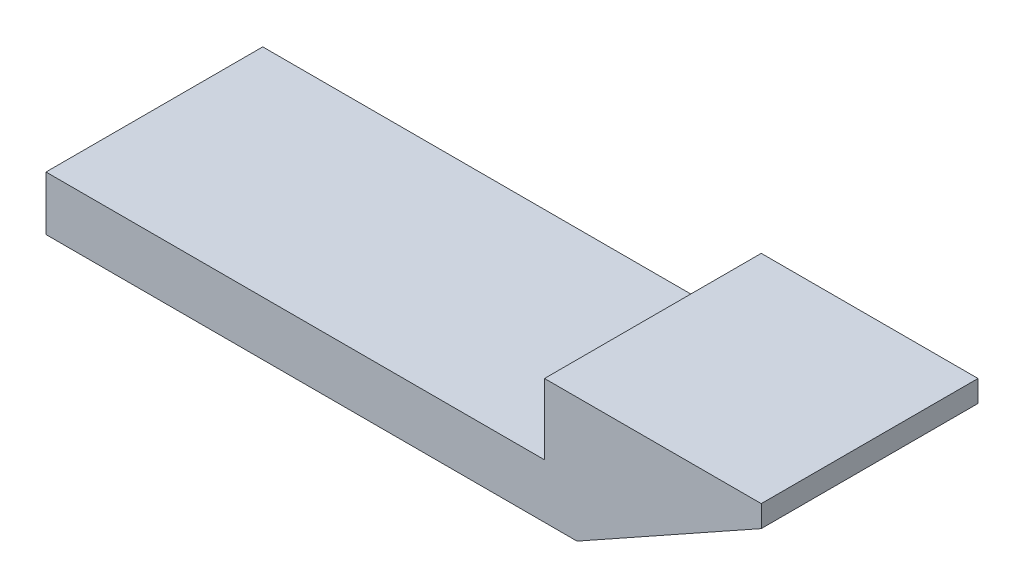
from build123d import *

# Parameters (mm, degrees)
SALIENTE_EXTRUIR1_DEPTH = 20


with BuildPart() as part:
    # Croquis1 → Saliente-Extruir1 (new body)
    with BuildSketch(Plane.XY):
        Polygon((-17.08621798, 0.540540541), (28.91378202, 0.540540541), (28.91378202, 7.040540541), (48.91378202, 7.040540541), (48.91378202, 5.040540541), (31.91378202, -4.459459459), (-17.08621798, -4.459459459), align=None)
    extrude(amount=SALIENTE_EXTRUIR1_DEPTH)


solid = part.part
